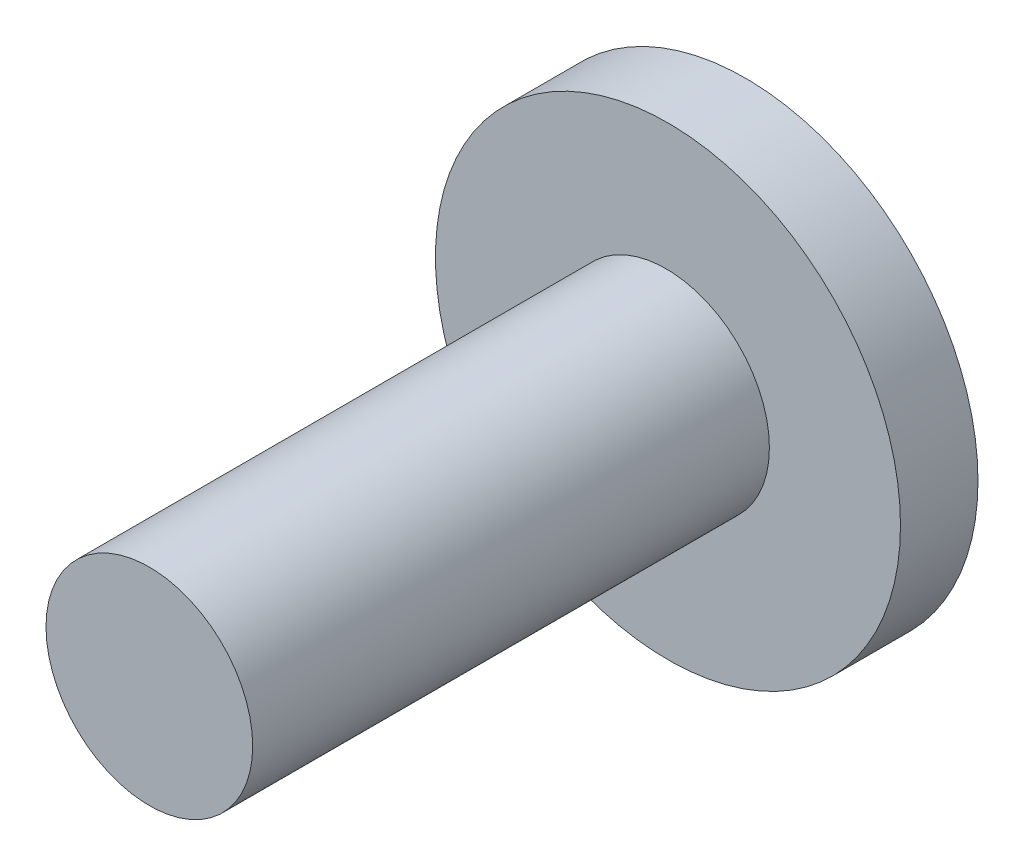
from build123d import *

# Parameters (mm, degrees)
SKETCH1_R                = 8
BOSS_EXTRUDE1_DEPTH      = 2
SKETCH2_R                = 9
BOSS_EXTRUDE2_DEPTH      = 3
CUT_EXTRUDE1_DEPTH       = 10.0001
CUT_EXTRUDE1_DEPTH_BACK  = 10
BOSS_EXTRUDE3_DEPTH      = 2
BOSS_EXTRUDE3_DEPTH_BACK = 0.0001
SKETCH1_3_R              = 8
SKETCH3_R                = 4
BOSS_EXTRUDE4_DEPTH      = 20


with BuildPart() as part:
    # Sketch1 → Boss-Extrude1 (new body)
    with BuildSketch(Plane.XY):
        Circle(SKETCH1_R)
        with BuildLine():
            Line((-2.100590034, 1.75), (2.142050653, 1.75))
            ThreePointArc((2.142050653, 1.75), (2.766022596, 0), (2.142050653, -1.75))
            Line((2.142050653, -1.75), (-2.100590034, -1.75))
            ThreePointArc((-2.100590034, -1.75), (-2.733195007, 0), (-2.100590034, 1.75))
        make_face(mode=Mode.SUBTRACT)
    extrude(amount=BOSS_EXTRUDE1_DEPTH)

    # Sketch2 → Boss-Extrude2 (add)
    with BuildSketch(Plane.XY.offset(2)):
        Circle(SKETCH2_R)
    extrude(amount=-BOSS_EXTRUDE2_DEPTH)

    # Sketch1<2> → Cut-Extrude1 (cut, two sides: drawn at the far end of the back side and taken through both)
    with BuildSketch(Plane.XY.offset(-CUT_EXTRUDE1_DEPTH_BACK)):
        with BuildLine():
            Line((2.142050653, 1.75), (-2.100590034, 1.75))
            ThreePointArc((-2.100590034, 1.75), (-2.733195007, 0), (-2.100590034, -1.75))
            Line((-2.100590034, -1.75), (2.142050653, -1.75))
            ThreePointArc((2.142050653, -1.75), (2.766022596, 0), (2.142050653, 1.75))
        make_face()
    extrude(amount=CUT_EXTRUDE1_DEPTH + CUT_EXTRUDE1_DEPTH_BACK, mode=Mode.SUBTRACT)

    # Sketch1<3> → Boss-Extrude3 (add, two sides: drawn at the far end of the back side and taken through both)
    with BuildSketch(Plane.XY.offset(-BOSS_EXTRUDE3_DEPTH_BACK)):
        Circle(SKETCH1_3_R)
    extrude(amount=BOSS_EXTRUDE3_DEPTH + BOSS_EXTRUDE3_DEPTH_BACK)

    # Sketch3 → Boss-Extrude4 (add)
    with BuildSketch(Plane.XY.offset(2)):
        with Locations((-0.074058603, 0.074058603)):
            Circle(SKETCH3_R)
    extrude(amount=BOSS_EXTRUDE4_DEPTH)


solid = part.part
